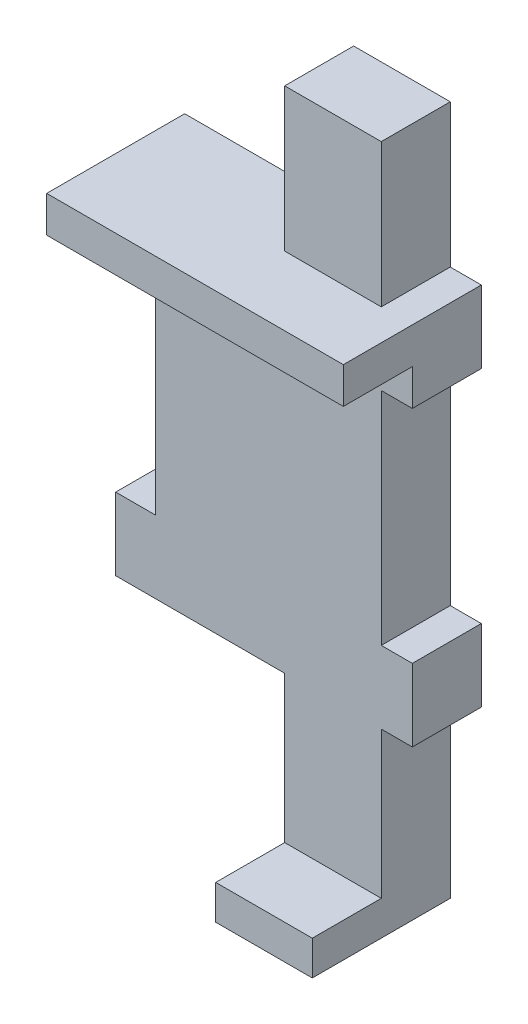
from build123d import *

# Parameters (mm, degrees)
SKETCH1_W               = 5.6
SKETCH1_H               = 40
BOSS_EXTRUDE1_DEPTH     = 4
SKETCH2_W               = 5.6
SKETCH2_H               = 2
BOSS_EXTRUDE2_DEPTH     = 4
SKETCH4_W               = 4
SKETCH4_H               = 4.2
BOSS_EXTRUDE3_DEPTH     = 1.8
MIRROR2_COPY_1_SKETCH_W = 4
MIRROR2_COPY_1_SKETCH_H = 4.2
MIRROR2_COPY_1_DEPTH    = 1.8
SKETCH8_W               = 4
SKETCH8_H               = 4.2
BOSS_EXTRUDE4_DEPTH     = 8
SKETCH9_W               = 17.2
SKETCH9_H               = 2.1
BOSS_EXTRUDE5_DEPTH     = 4
SKETCH10_W              = 4
SKETCH10_H              = 12.8
BOSS_EXTRUDE6_DEPTH     = 7.5
SKETCH11_R              = 1.5
CUT_EXTRUDE1_DEPTH      = 1


with BuildPart() as part:
    # Sketch1 → Boss-Extrude1 (new body)
    with BuildSketch(Plane.XY):
        Rectangle(SKETCH1_W, SKETCH1_H)
    extrude(amount=BOSS_EXTRUDE1_DEPTH)

    # Sketch2 → Boss-Extrude2 (add)
    with BuildSketch(Plane.XY.offset(4)):
        with Locations((0, -19)):
            Rectangle(SKETCH2_W, SKETCH2_H)
    extrude(amount=BOSS_EXTRUDE2_DEPTH)

    # Sketch4 → Boss-Extrude3 (add)
    with BuildSketch(Plane.ZY.offset(2.8)):
        with Locations((2, 9.6)):
            Rectangle(SKETCH4_W, SKETCH4_H)
    boss_extrude3 = extrude(amount=BOSS_EXTRUDE3_DEPTH)

    # Mirror1: Boss-Extrude3 across plane
    add(boss_extrude3.mirror(Plane.ZY))

    # Mirror2: Boss-Extrude3 across plane
    add(boss_extrude3.mirror(Plane(origin=(0, 1.1, 0), x_dir=(0, 0, 1), z_dir=(0, -1, 0))))

    # Mirror2 copy 1 sketch → Mirror2 copy 1 (add)
    with BuildSketch(Plane(origin=(2.8, 2.2, 0), x_dir=(0, 0, 1), z_dir=(1, 0, 0))):
        with Locations((2, 9.6)):
            Rectangle(MIRROR2_COPY_1_SKETCH_W, MIRROR2_COPY_1_SKETCH_H)
    extrude(amount=MIRROR2_COPY_1_DEPTH)

    # Sketch8 → Boss-Extrude4 (add)
    with BuildSketch(Plane.ZY.offset(4.6)):
        with Locations((2, 9.6)):
            Rectangle(SKETCH8_W, SKETCH8_H)
        with Locations((2, -7.4)):
            Rectangle(SKETCH8_W, SKETCH8_H)
    extrude(amount=BOSS_EXTRUDE4_DEPTH)

    # Sketch9 → Boss-Extrude5 (add)
    with BuildSketch(Plane.XY.offset(4)):
        with Locations((-4, 10.65)):
            Rectangle(SKETCH9_W, SKETCH9_H)
    extrude(amount=BOSS_EXTRUDE5_DEPTH)

    # Sketch10 → Boss-Extrude6 (add)
    with BuildSketch(Plane.ZY.offset(2.8)):
        with Locations((2, 1.1)):
            Rectangle(SKETCH10_W, SKETCH10_H)
    extrude(amount=BOSS_EXTRUDE6_DEPTH)

    # Sketch11 → Cut-Extrude1 (cut)
    with BuildSketch(Plane(origin=(0, 0, 0), x_dir=(-1, 0, 0), z_dir=(0, 0, -1))):
        with Locations((4.9, 1.1)):
            Circle(SKETCH11_R)
    extrude(amount=-CUT_EXTRUDE1_DEPTH, mode=Mode.SUBTRACT)


solid = part.part
